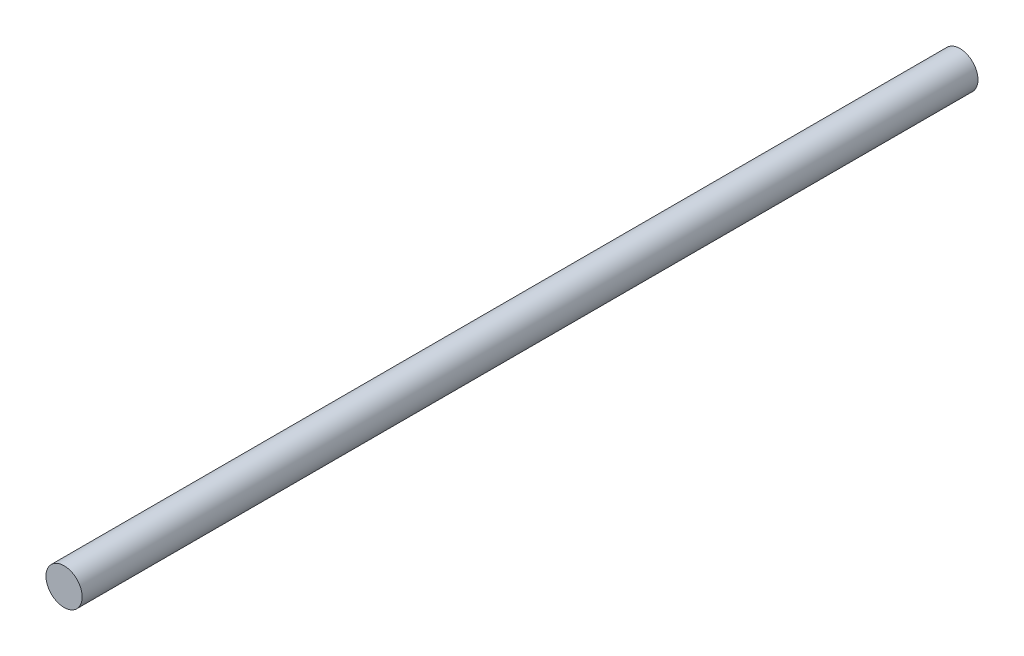
from build123d import *

# Parameters (mm, degrees)
SKETCH1_R           = 4
BOSS_EXTRUDE1_DEPTH = 198


with BuildPart() as part:
    # Sketch1 → Boss-Extrude1 (new body)
    with BuildSketch(Plane.XY):
        Circle(SKETCH1_R)
    extrude(amount=BOSS_EXTRUDE1_DEPTH)


solid = part.part
